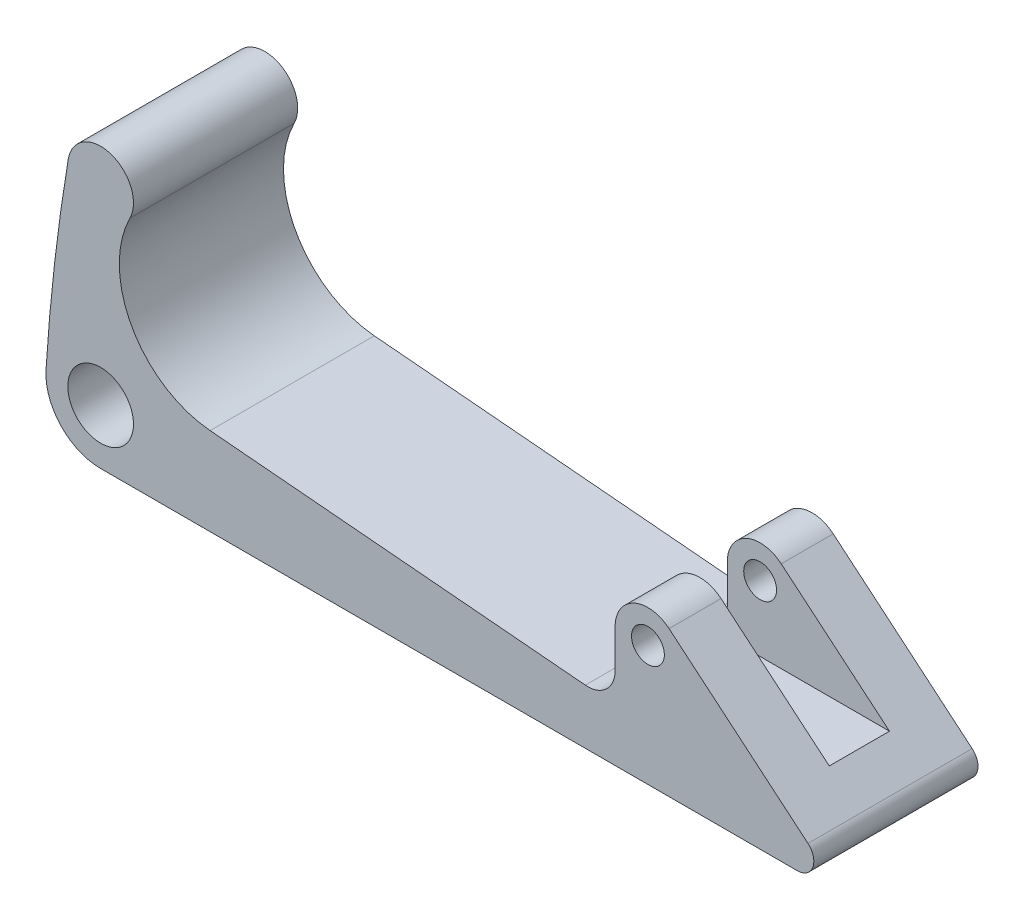
from build123d import *

# Parameters (mm, degrees)
SKETCH1_R           = 3
SKETCH1_R_2         = 1.5
BOSS_EXTRUDE1_DEPTH = 7.5
CUT_EXTRUDE1_REACH  = 70.715
SKETCH2_W           = 20.337315641
SKETCH2_H           = 5.5


with BuildPart() as part:
    # Sketch1 → Boss-Extrude1 (new, symmetric)
    with BuildSketch(Plane.XY):
        with BuildLine():
            Line((0, -5), (63.65524487, -5))
            ThreePointArc((63.65524487, -5), (65.064783801, -4.013030215), (64.619426284, -2.350933335))
            Line((64.619426284, -2.350933335), (51.928362829, 8.298133329))
            ThreePointArc((51.928362829, 8.298133329), (48.732145215, 8.718923361), (47, 6))
            Line((47, 6), (47, 2.491190702))
            ThreePointArc((47, 2.491190702), (46.188975519, 0.64799736), (44.282110643, 0.000703957))
            Line((44.282110643, 0.000703957), (10, 3))
            ThreePointArc((10, 3), (2.85176017, 7.632257918), (2.678290028, 16.148422208))
            ThreePointArc((2.678290028, 16.148422208), (0.935327464, 20.350467073), (-2.958378986, 17.997989735))
            ThreePointArc((-2.958378986, 17.997989735), (-4.206114513, 9.18048564), (-4.990396875, 0.30974026))
            ThreePointArc((-4.990396875, 0.30974026), (-3.643398228, -3.424273551), (0, -5))
        make_face()
        Circle(SKETCH1_R, mode=Mode.SUBTRACT)
        with Locations((50, 6)):
            Circle(SKETCH1_R_2, mode=Mode.SUBTRACT)
    extrude(amount=BOSS_EXTRUDE1_DEPTH, both=True)

    # Sketch2 → Cut-Extrude1 (cut, up to next)
    with BuildSketch(Plane(origin=(0, 0, 0), x_dir=(1, 0, 0), z_dir=(0, 1, 0)), mode=Mode.PRIVATE) as cut_extrude1_sk1:
        with Locations((54.450768463, 0)):
            Rectangle(SKETCH2_W, SKETCH2_H)
    cut_extrude1_tool1 = extrude(cut_extrude1_sk1.sketch, amount=CUT_EXTRUDE1_REACH, mode=Mode.PRIVATE) & part.part
    add(cut_extrude1_tool1.solids().sort_by_distance((54.450768, 0, 0))[0], mode=Mode.SUBTRACT)


solid = part.part
